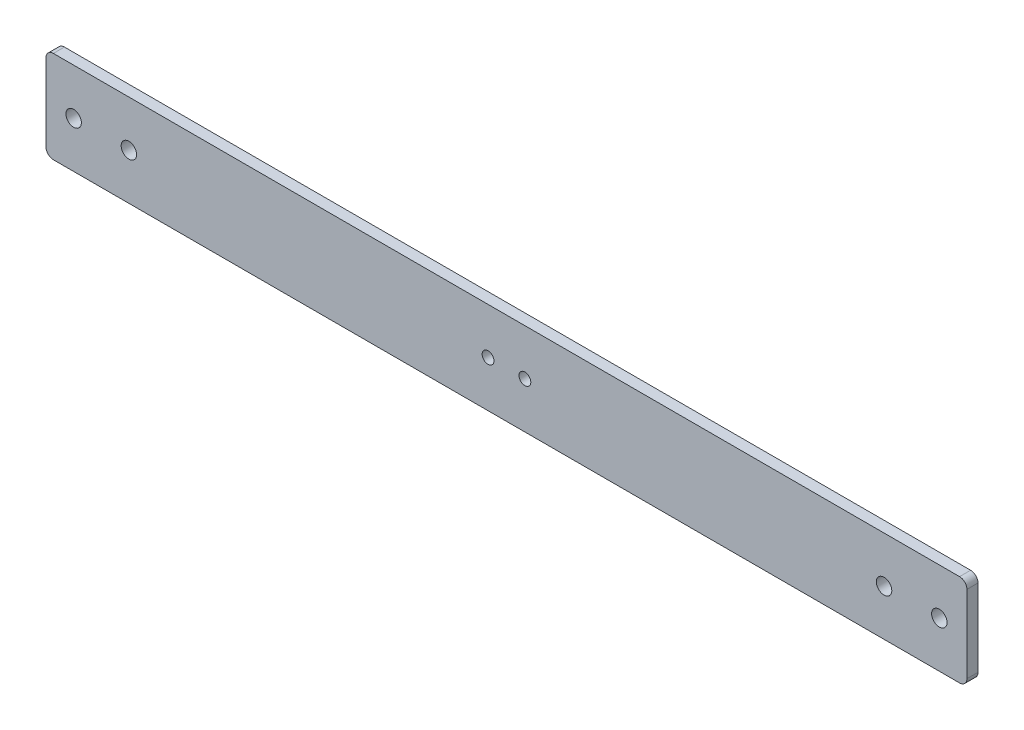
from build123d import *

# Parameters (mm, degrees)
SKETCH_1_W          = 250
SKETCH_1_H          = 25
EXTRUDE_1_DEPTH     = 3
SKETCH_2_R          = 2.1
SKETCH_2_R_2        = 1.6
CUT_EXTRUDE_1_DEPTH = 3
FILLET_1_R          = 2


with BuildPart() as part:
    # 草图1 → 凸台-拉伸1 (new body)
    with BuildSketch(Plane.XY):
        Rectangle(SKETCH_1_W, SKETCH_1_H)
    extrude(amount=EXTRUDE_1_DEPTH)

    # 草图2 → 切除-拉伸1 (cut)
    with BuildSketch(Plane.XY.offset(3)):
        with Locations((-117.5, 0)):
            Circle(SKETCH_2_R)
        with Locations((-102.5, 0)):
            Circle(SKETCH_2_R)
        with Locations(Location((102.5, 0, 0), (0, 0, 180))):
            Circle(SKETCH_2_R)
        with Locations(Location((117.5, 0, 0), (0, 0, 180))):
            Circle(SKETCH_2_R)
        with Locations((-5, 0)):
            Circle(SKETCH_2_R_2)
        with Locations(Location((5, 0, 0), (0, 0, 180))):
            Circle(SKETCH_2_R_2)
    extrude(amount=-CUT_EXTRUDE_1_DEPTH, mode=Mode.SUBTRACT)

    # 圆角1
    fillet_1_edges = [part.edges().sort_by_distance(p)[0] for p in [
        (125, -12.5, 1.5),
        (-125, -12.5, 1.5),
        (-125, 12.5, 1.5),
        (125, 12.5, 1.5),
    ]]
    fillet(fillet_1_edges, radius=FILLET_1_R)


solid = part.part
